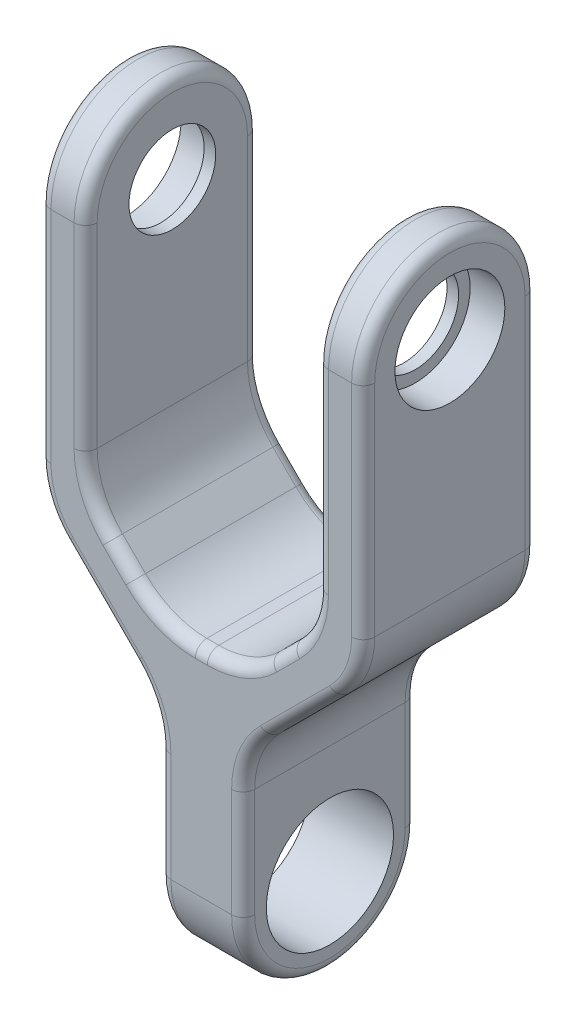
from build123d import *

# Parameters (mm, degrees)
EXTRUDE_1_DEPTH     = 30
CUT_EXTRUDE_1_DEPTH = 102.205545797
EXTRUDE_2_DEPTH     = 14.5
SKETCH_4_R          = 11
CUT_EXTRUDE_2_DEPTH = 20
EXTRUDE_3_DEPTH     = 8
EXTRUDE_START       = -8
EXTRUDE_4_DEPTH     = 8
SKETCH_9_R          = 7.5
CUT_EXTRUDE_5_DEPTH = 62
SKETCH_10_R         = 9.5
CUT_EXTRUDE_6_DEPTH = 6
CUT_EXTRUDE_START   = -6
SKETCH_11_R         = 9.5
CUT_EXTRUDE_7_DEPTH = 6
FILLET_1_R          = 15
FILLET_2_R          = 2


with BuildPart() as part:
    # 草图1 → 凸台-拉伸1 (new body)
    with BuildSketch(Plane.XY):
        Polygon((0, 0), (14.5, 0), (14.5, 25), (35.25, 45.75), (35.25, 90), (27.25, 90), (27.25, 50), (-12.75, 50), (-12.75, 90), (-20.75, 90), (-20.75, 45.75), (0, 25), align=None)
    extrude(amount=EXTRUDE_1_DEPTH)

    # 草图2 → 切除-拉伸1 (cut, through all)
    with BuildSketch(Plane.XY.offset(30)):
        Polygon((-12.75, 50), (0, 37.25), (14.5, 37.25), (27.25, 50), align=None)
    extrude(amount=-CUT_EXTRUDE_1_DEPTH, mode=Mode.SUBTRACT)

    # 草图3 → 凸台-拉伸2 (add)
    with BuildSketch(Plane(origin=(14.5, 0, 0), x_dir=(0, 0, -1), z_dir=(1, 0, 0))):
        with BuildLine():
            Line((-30, 0), (0, 0))
            ThreePointArc((0, 0), (-15, -15), (-30, 0))
        make_face()
    extrude(amount=-EXTRUDE_2_DEPTH)

    # 草图4 → 切除-拉伸2 (cut)
    with BuildSketch(Plane(origin=(14.5, 0, 0), x_dir=(0, 0, -1), z_dir=(1, 0, 0))):
        with Locations((-15, 0)):
            Circle(SKETCH_4_R)
    extrude(amount=-CUT_EXTRUDE_2_DEPTH, mode=Mode.SUBTRACT)

    # 草图7 → 凸台-拉伸3 (add)
    with BuildSketch(Plane(origin=(35.25, 0, 0), x_dir=(0, 0, -1), z_dir=(1, 0, 0))):
        with BuildLine():
            Line((-30, 90), (0, 90))
            ThreePointArc((0, 90), (-15, 105), (-30, 90))
        make_face()
    extrude(amount=-EXTRUDE_3_DEPTH)

    # 草图8 → 凸台-拉伸4 (add)
    with BuildSketch(Plane.ZY.offset(20.75).offset(EXTRUDE_START)):
        with BuildLine():
            Line((0, 90), (30, 90))
            ThreePointArc((30, 90), (15, 105), (0, 90))
        make_face()
    extrude(amount=EXTRUDE_4_DEPTH)

    # 草图9 → 切除-拉伸5 (cut)
    with BuildSketch(Plane.ZY.offset(20.75)):
        with Locations(Location((15, 90, 0), (0, 0, 270))):
            Circle(SKETCH_9_R)
    extrude(amount=-CUT_EXTRUDE_5_DEPTH, mode=Mode.SUBTRACT)

    # 草图10 → 切除-拉伸6 (cut)
    with BuildSketch(Plane.ZY.offset(20.75)):
        with Locations(Location((15, 90, 0), (0, 0, 270))):
            Circle(SKETCH_10_R)
    extrude(amount=-CUT_EXTRUDE_6_DEPTH, mode=Mode.SUBTRACT)

    # 草图11 → 切除-拉伸7 (cut)
    with BuildSketch(Plane(origin=(35.25, 0, 0), x_dir=(0, 0, -1), z_dir=(1, 0, 0)).offset(CUT_EXTRUDE_START)):
        with Locations(Location((-15, 90, 0), (0, 0, 270))):
            Circle(SKETCH_11_R)
    extrude(amount=CUT_EXTRUDE_7_DEPTH, mode=Mode.SUBTRACT)

    # 圆角1
    fillet_1_edges = [part.edges().sort_by_distance(p)[0] for p in [
        (0, 25, 15),
        (-20.75, 45.75, 15),
        (-12.75, 50, 15),
        (27.25, 50, 15),
        (35.25, 45.75, 15),
        (14.5, 25, 15),
        (14.5, 37.25, 15),
        (0, 37.25, 15),
    ]]
    fillet(fillet_1_edges, radius=FILLET_1_R)

    # 圆角2
    fillet_2_edges = [part.edges().sort_by_distance(p)[0] for p in [
        (-12.75, 73.106601718, 0),
        (-12.75, 73.106601718, 30),
        (-6.375, 43.625, 30),
        (-6.375, 43.625, 0),
        (7.25, 37.25, 30),
        (7.25, 37.25, 0),
        (20.875, 43.625, 30),
        (20.875, 43.625, 0),
        (0, 9.393398282, 0),
        (0, 9.393398282, 30),
        (-10.375, 35.375, 0),
        (-10.375, 35.375, 30),
        (35.25, 70.981601718, 0),
        (24.875, 35.375, 0),
        (34.108192988, 46.22295195, 0),
        (-19.608192988, 46.22295195, 0),
        (24.875, 35.375, 30),
        (35.25, 70.981601718, 30),
        (34.108192988, 46.22295195, 30),
        (-19.608192988, 46.22295195, 30),
        (-11.608192988, 50.47295195, 0),
        (-11.608192988, 50.47295195, 30),
        (-20.75, 70.981601718, 0),
        (0.47295195, 38.391807012, 30),
        (0.47295195, 38.391807012, 0),
        (14.02704805, 38.391807012, 30),
        (14.02704805, 38.391807012, 0),
        (26.108192988, 50.47295195, 0),
        (26.108192988, 50.47295195, 30),
        (-1.141807012, 24.52704805, 0),
        (-1.141807012, 24.52704805, 30),
        (14.5, 9.393398282, 30),
        (15.641807012, 24.52704805, 0),
        (15.641807012, 24.52704805, 30),
        (27.25, 73.106601718, 0),
        (14.5, 9.393398282, 0),
        (27.25, 73.106601718, 30),
        (-20.75, 70.981601718, 30),
        (14.5, -15, 15),
        (0, -15, 15),
        (35.25, 105, 15),
        (27.25, 105, 15),
        (-20.75, 105, 15),
        (-12.75, 105, 15),
    ]]
    fillet(fillet_2_edges, radius=FILLET_2_R)


solid = part.part
